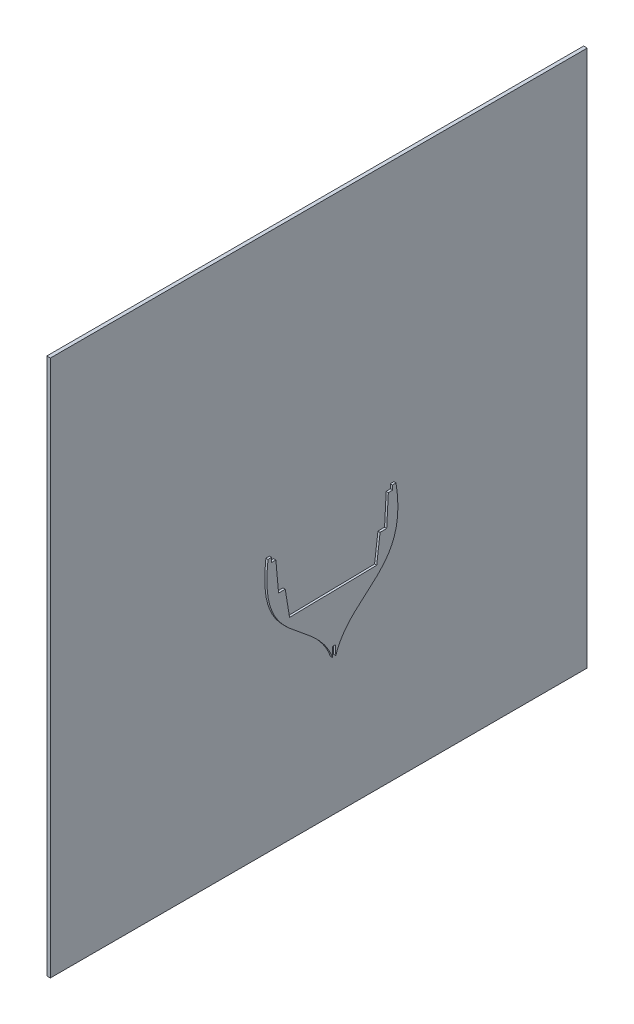
from build123d import *

# Parameters (mm, degrees)
BOSS_EXTRU_2_DEPTH      = 10
BOSS_EXTRU_3_DEPTH      = 6
ENL_V_MAT_EXTRU_1_DEPTH = 6


with BuildPart() as part:
    # Esquisse3D1 → Boss.-Extru.2 (new body)
    with BuildSketch(Plane(origin=(-20, 1121.289346724, 777.274991403), x_dir=(0, -0.7071067811865476, -0.7071067811865476), z_dir=(1, 0, 0))):
        Polygon((0, 0), (1060.66017178, 1060.66017178), (2121.32034356, 0), (1060.66017178, -1060.66017178), align=None)
    extrude(amount=BOSS_EXTRU_2_DEPTH)


with BuildPart() as body_2:
    # Esquisse5 → Boss.-Extru.3 (new body)
    with BuildSketch(Plane(origin=(0, 0, 0), x_dir=(0, 0, -1), z_dir=(1, 0, 0))):
        with BuildLine():
            Line((172.4622394, 352.332448072), (162.4622394, 352.1512943))
            Line((162.4622394, 352.1512943), (163.223727317, 339.801338053))
            Line((163.223727317, 339.801338053), (151.0185207, 339.58023613))
            Line((151.0185207, 339.58023613), (146.47299258, 255.274664597))
            Line((146.47299258, 255.274664597), (127.994738238, 254.939924049))
            Line((127.994738238, 254.939924049), (118.526672474, 180.005385852))
            Line((118.526672474, 180.005385852), (-124.968496367, 175.594379009))
            Line((-124.968496367, 175.594379009), (-137.144394156, 250.13682864))
            Line((-137.144394156, 250.13682864), (-155.622648498, 249.802088092))
            Line((-155.622648498, 249.802088092), (-163.218646637, 333.887711296))
            Line((-163.218646637, 333.887711296), (-175.423853255, 333.666609374))
            Line((-175.423853255, 333.666609374), (-175.110166408, 346.036042818))
            Line((-175.110166408, 346.036042818), (-185.110166408, 345.854889045))
            add(Edge.make_bspline(
                [(0, 0), (-2.509062985, 16.019137781), (-32.842513655, 167.349631388), (-216.874652949, 92.90546411), (-185.110166408, 345.854889045)],
                knots=[0, 0, 0, 0, 0, 1, 1, 1, 1, 1], degree=4))
            add(Edge.make_bspline(
                [(0, 0), (1.927221695, 16.099502752), (26.759750752, 168.429348893), (213.36742668, 100.699461693), (172.4622394, 352.332448072)],
                knots=[0, 0, 0, 0, 0, 1, 1, 1, 1, 1], degree=4))
        make_face()
    extrude(amount=BOSS_EXTRU_3_DEPTH)

    # Esquisse6 → Enlèv. mat.-Extru.1 (cut)
    with BuildSketch(Plane(origin=(6, 0, 0), x_dir=(0, 0, -1), z_dir=(1, 0, 0))):
        Polygon((-4.835020381, 18.412182381), (-5.324135567, 45.412182381), (3.675864433, 45.575220776), (4.164979619, 18.575220776), (117.063261114, -47.52702125), (-85.227699586, -65.220017949), align=None)
    extrude(amount=-ENL_V_MAT_EXTRU_1_DEPTH, mode=Mode.SUBTRACT)


solid = Compound([part.part, body_2.part])
